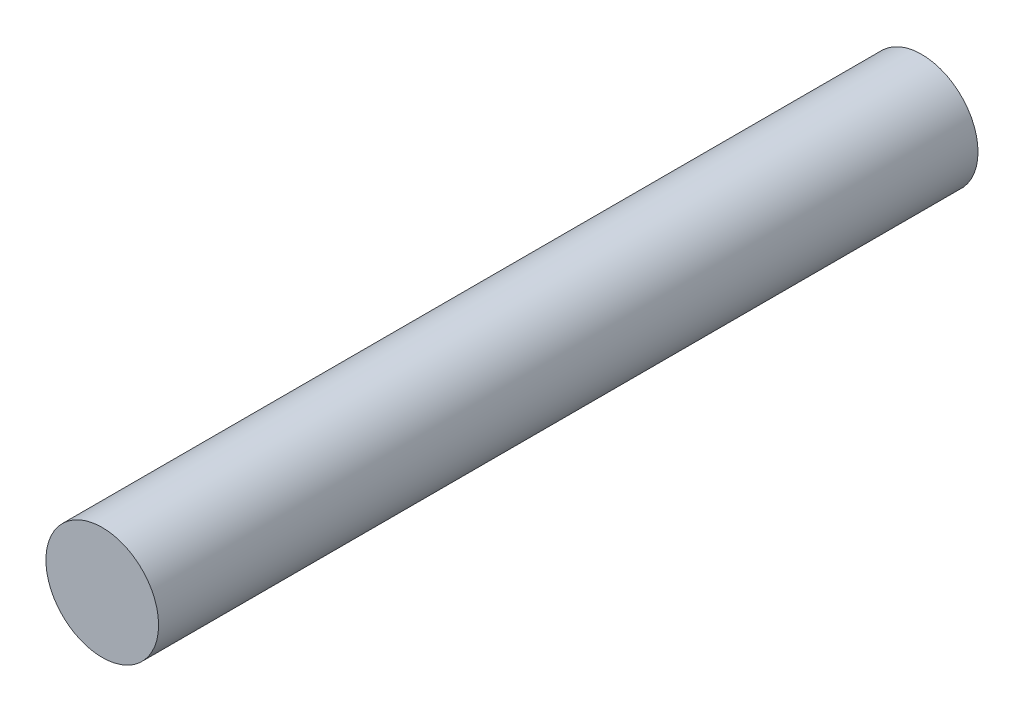
from build123d import *

# Parameters (mm, degrees)
SKETCH_1_R      = 4
EXTRUDE_1_DEPTH = 58.18


with BuildPart() as part:
    # 草图1 → 凸台-拉伸1 (new body)
    with BuildSketch(Plane.XY):
        Circle(SKETCH_1_R)
    extrude(amount=EXTRUDE_1_DEPTH)


solid = part.part
